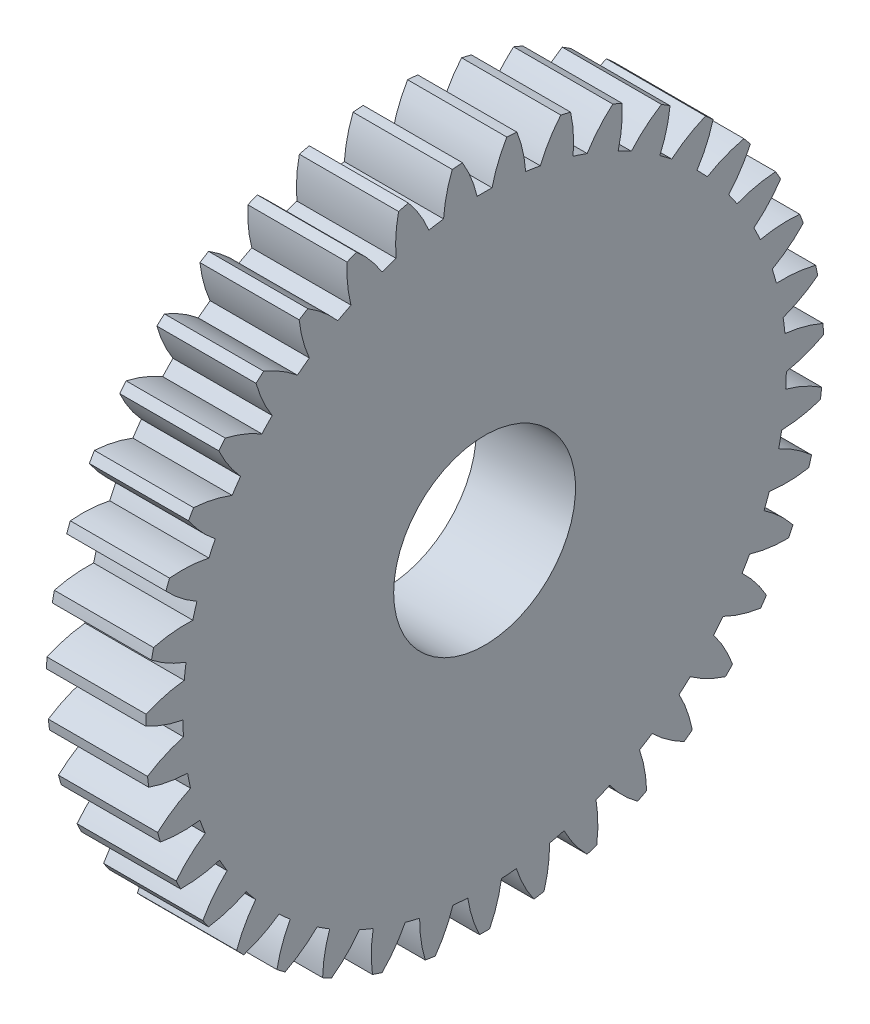
from build123d import *

# Parameters (mm, degrees)
BASPROSKE_W     = 6
BASPROSKE_H     = 20.5
TOOTHCUT_DEPTH  = 30.605742686
TEETHCUTS_COUNT = 39
TEETHCUTS_ANGLE = 350.769230769
BORSKE_R        = 5.5
BORE_DEPTH      = 50.0000508


with BuildPart() as part:
    # BasProSke → Base-Revolve (revolve)
    with BuildSketch(Plane(origin=(0, 0, 0), x_dir=(1, 0, 0), z_dir=(0, 1, 0)), mode=Mode.PRIVATE) as base_revolve_sk:
        with Locations((3, 10.25)):
            Rectangle(BASPROSKE_W, BASPROSKE_H)
    revolve(base_revolve_sk.sketch.rotate(Axis((-10, 0, 0), (1, 0, 0)), 180), axis=Axis((-10, 0, 0), (1, 0, 0)))

    # TooCutSke → ToothCut (cut, through all)
    with BuildSketch(Plane(origin=(0, 0, 0), x_dir=(0, 0, -1), z_dir=(1, 0, 0))):
        with BuildLine():
            ThreePointArc((0.450063598, 18.243449338), (0, 18.249), (-0.450063598, 18.243449338))
            ThreePointArc((-0.450063598, 18.243449338), (-0.816963734, 19.397278425), (-1.358007102, 20.480426311))
            ThreePointArc((-1.358007102, 20.480426311), (0, 20.5254), (1.358007102, 20.480426311))
            ThreePointArc((1.358007102, 20.480426311), (0.816963734, 19.397278425), (0.450063598, 18.243449338))
        make_face()
    toothcut = extrude(amount=TOOTHCUT_DEPTH, mode=Mode.SUBTRACT)

    # TeethCuts: ToothCut ×39 about axis
    teethcuts_axis = Axis((-10, 0, 0), (1, 0, 0))
    for i in range(1, TEETHCUTS_COUNT):
        add(toothcut.rotate(teethcuts_axis, i * TEETHCUTS_ANGLE / (TEETHCUTS_COUNT - 1)), mode=Mode.SUBTRACT)

    # BorSke → Bore (cut, symmetric)
    with BuildSketch(Plane(origin=(0, 0, 0), x_dir=(0, 0, -1), z_dir=(1, 0, 0))):
        with Locations(Location((0, 0, 0), (0, 0, 180))):
            Circle(BORSKE_R)
    extrude(amount=BORE_DEPTH, both=True, mode=Mode.SUBTRACT)


solid = part.part
